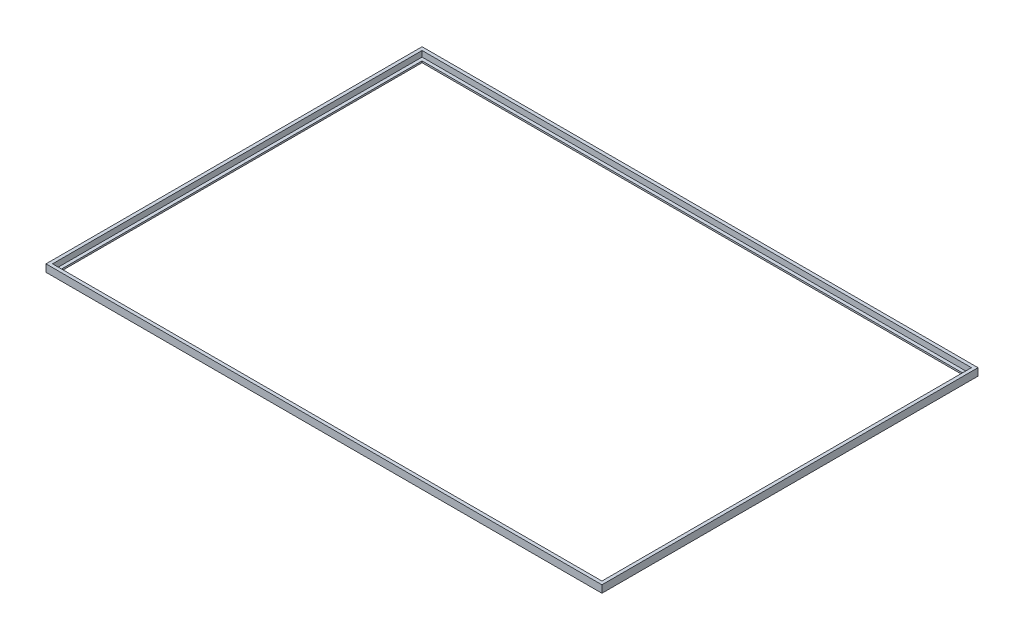
from build123d import *

# Parameters (mm, degrees)
SKETCH1_W           = 170
SKETCH1_H           = 115
SKETCH1_W_2         = 166
SKETCH1_H_2         = 111
BOSS_EXTRUDE1_DEPTH = 2.75
SKETCH2_W           = 168
SKETCH2_H           = 113
CUT_EXTRUDE1_DEPTH  = 1.75
CHAMFER1_SIZE       = 0.5


with BuildPart() as part:
    # Sketch1 → Boss-Extrude1 (new body)
    with BuildSketch(Plane(origin=(0, 0, 0), x_dir=(1, 0, 0), z_dir=(0, 1, 0))):
        with Locations((85, 57.5)):
            Rectangle(SKETCH1_W, SKETCH1_H)
        with Locations((85, 57.5)):
            Rectangle(SKETCH1_W_2, SKETCH1_H_2, mode=Mode.SUBTRACT)
    extrude(amount=BOSS_EXTRUDE1_DEPTH)

    # Sketch2 → Cut-Extrude1 (cut)
    with BuildSketch(Plane(origin=(0, 2.75, 0), x_dir=(1, 0, 0), z_dir=(0, 1, 0))):
        with Locations((85, 57.5)):
            Rectangle(SKETCH2_W, SKETCH2_H)
    extrude(amount=-CUT_EXTRUDE1_DEPTH, mode=Mode.SUBTRACT)

    # Chamfer1
    chamfer1_edges = [part.edges().sort_by_distance(p)[0] for p in [
        (2, 0, -57.5),
        (85, 0, -2),
        (168, 0, -57.5),
        (85, 0, -113),
        (85, 0, -115),
        (170, 0, -57.5),
        (85, 0, 0),
        (0, 0, -57.5),
    ]]
    chamfer(chamfer1_edges, length=CHAMFER1_SIZE)


solid = part.part
